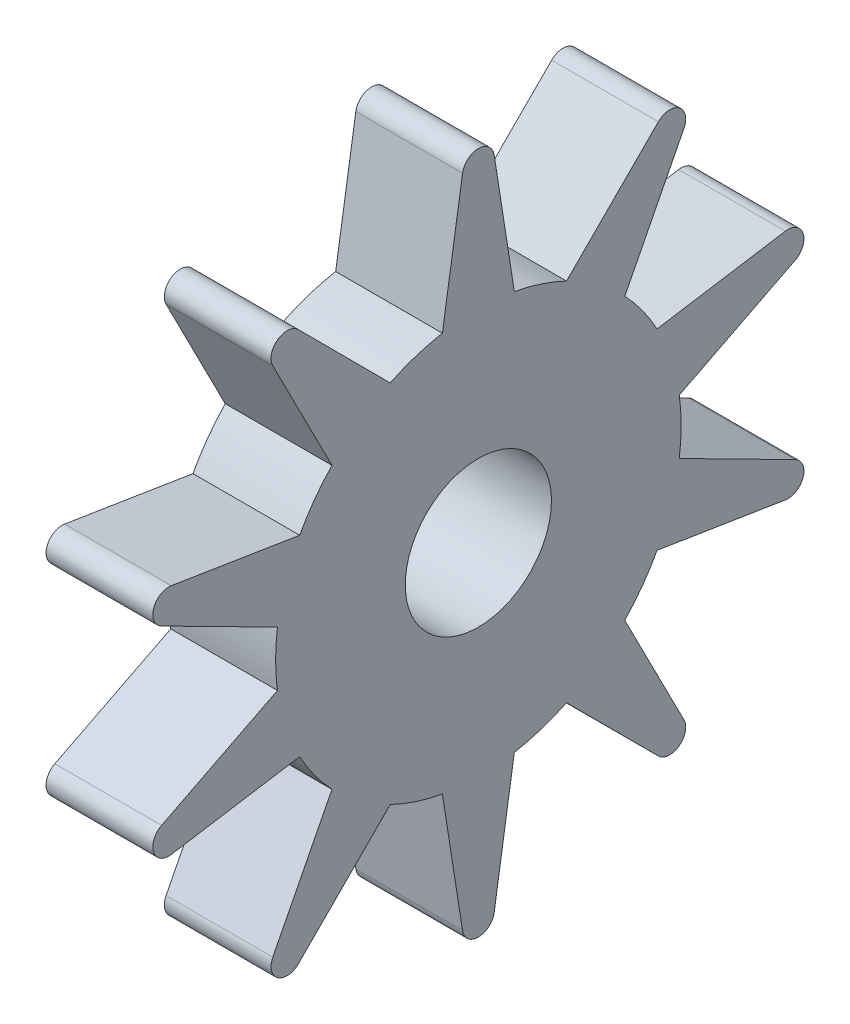
from build123d import *

# Parameters (mm, degrees)
SKETCH2_R           = 9.5
SKETCH2_R_2         = 3.425
BOSS_EXTRUDE3_DEPTH = 5
BOSS_EXTRUDE5_DEPTH = 5
CIRPATTERN1_COUNT   = 10


with BuildPart() as part:
    # Sketch2 → Boss-Extrude3 (new body)
    with BuildSketch(Plane(origin=(0, 0, 0), x_dir=(0, 0, -1), z_dir=(1, 0, 0))):
        Circle(SKETCH2_R)
        Circle(SKETCH2_R_2, mode=Mode.SUBTRACT)
    extrude(amount=BOSS_EXTRUDE3_DEPTH)

    # Sketch4 → Boss-Extrude5 (add)
    with BuildSketch(Plane.ZY):
        with BuildLine():
            Line((-0.740931013, 15.366280839), (-1.685223767, 9.349332642))
            ThreePointArc((-1.685223767, 9.349332642), (0, 9.5), (1.685223767, 9.349332642))
            Line((1.685223767, 9.349332642), (0.740931013, 15.366280839))
            ThreePointArc((0.740931013, 15.366280839), (0, 16), (-0.740931013, 15.366280839))
        make_face()
    boss_extrude5 = extrude(amount=-BOSS_EXTRUDE5_DEPTH)

    # CirPattern1: Boss-Extrude5 ×10 about axis
    cirpattern1_axis = Axis((0, 0, 0), (1, 0, 0))
    for i in range(1, CIRPATTERN1_COUNT):
        add(boss_extrude5.rotate(cirpattern1_axis, i * 360 / CIRPATTERN1_COUNT))


solid = part.part
